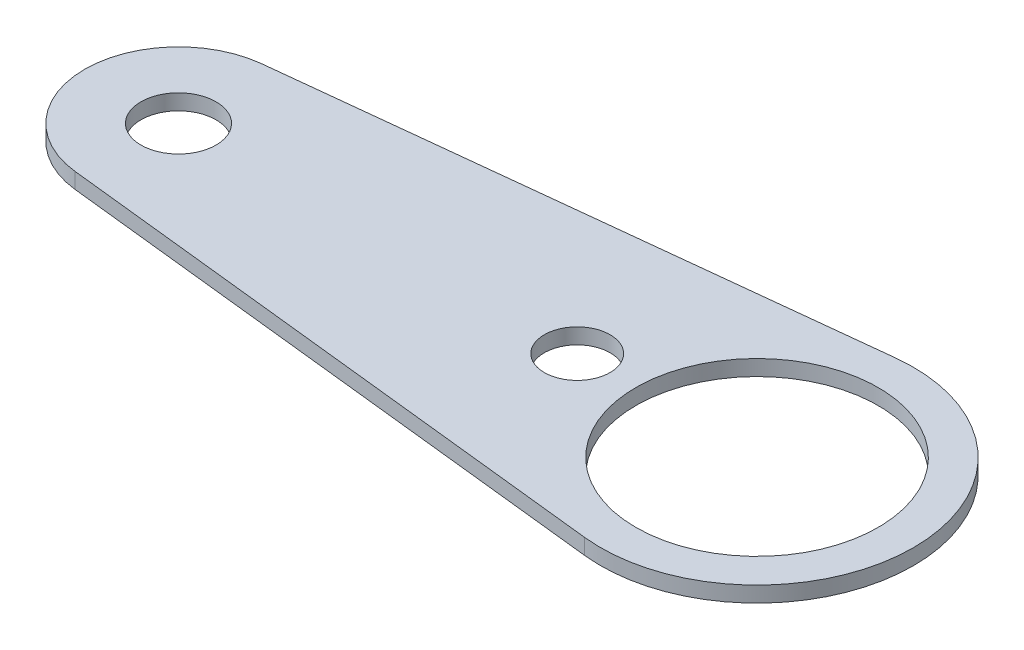
from build123d import *

# Parameters (mm, degrees)
SKETCH1_R           = 2.4
SKETCH1_R_2         = 7.75
SKETCH1_R_3         = 2.1
BOSS_EXTRUDE1_DEPTH = 1


with BuildPart() as part:
    # Sketch1 → Boss-Extrude1 (new body)
    with BuildSketch(Plane(origin=(0, 0, 0), x_dir=(1, 0, 0), z_dir=(0, 1, 0))):
        with BuildLine():
            Line((-1.081081081, 9.941391437), (-37.648648649, 5.964834862))
            ThreePointArc((-37.648648649, 5.964834862), (-43, 0), (-37.648648649, -5.964834862))
            Line((-37.648648649, -5.964834862), (-1.081081081, -9.941391437))
            ThreePointArc((-1.081081081, -9.941391437), (10, 0), (-1.081081081, 9.941391437))
        make_face()
        with Locations(Location((-37, 0, 0), (0, 0, 270))):
            Circle(SKETCH1_R, mode=Mode.SUBTRACT)
        with Locations(Location((0, 0, 0), (0, 0, 270))):
            Circle(SKETCH1_R_2, mode=Mode.SUBTRACT)
        with Locations(Location((-11.5, 0, 0), (0, 0, 270))):
            Circle(SKETCH1_R_3, mode=Mode.SUBTRACT)
    extrude(amount=BOSS_EXTRUDE1_DEPTH)


solid = part.part
